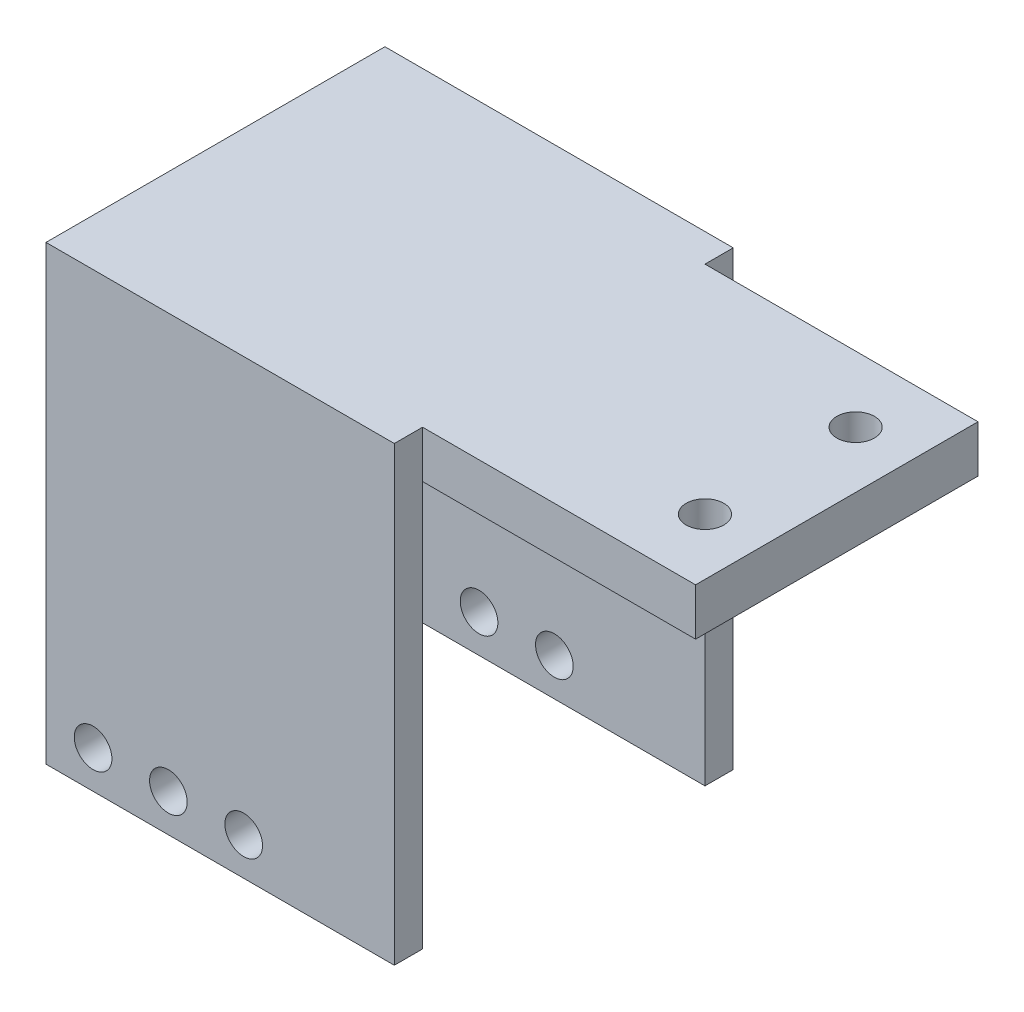
from build123d import *

# Parameters (mm, degrees)
SKETCH_1_W          = 66
SKETCH_1_H          = 30
SKETCH_1_R          = 2
EXTRUDE_1_DEPTH     = 5
SKETCH_2_W          = 37
SKETCH_2_H          = 3
EXTRUDE_2_DEPTH     = 48
SKETCH_3_R          = 2
CUT_EXTRUDE_2_DEPTH = 44


with BuildPart() as part:
    # 草圖1 → 填料-伸長1 (new body)
    with BuildSketch(Plane(origin=(0, 0, 0), x_dir=(1, 0, 0), z_dir=(0, 1, 0))):
        with Locations((33, 15)):
            Rectangle(SKETCH_1_W, SKETCH_1_H)
        with Locations(Location((60, 23, 0), (0, 0, 270))):
            Circle(SKETCH_1_R, mode=Mode.SUBTRACT)
        with Locations(Location((60, 7, 0), (0, 0, 270))):
            Circle(SKETCH_1_R, mode=Mode.SUBTRACT)
    extrude(amount=EXTRUDE_1_DEPTH)

    # 草圖2 → 填料-伸長2 (add)
    with BuildSketch(Plane(origin=(0, 5, 0), x_dir=(1, 0, 0), z_dir=(0, 1, 0))):
        with Locations((18.5, 31.5)):
            Rectangle(SKETCH_2_W, SKETCH_2_H)
        with Locations((18.5, -1.5)):
            Rectangle(SKETCH_2_W, SKETCH_2_H)
    extrude(amount=-EXTRUDE_2_DEPTH)

    # 草圖3 → 除料-伸長2 (cut)
    with BuildSketch(Plane.XY.offset(3)):
        with Locations((21, -39)):
            Circle(SKETCH_3_R)
        with Locations((13, -39)):
            Circle(SKETCH_3_R)
        with Locations((5, -39)):
            Circle(SKETCH_3_R)
    extrude(amount=-CUT_EXTRUDE_2_DEPTH, mode=Mode.SUBTRACT)


solid = part.part
